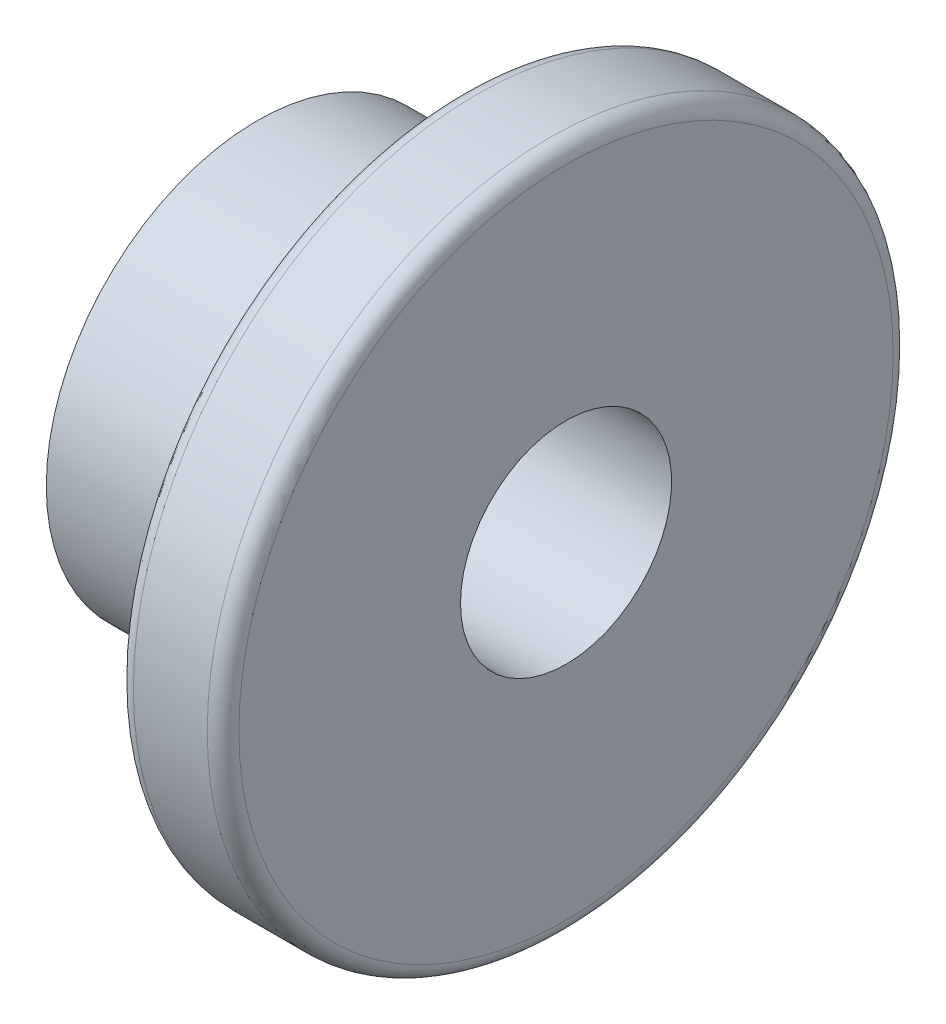
from build123d import *

# Parameters (mm, degrees)
CONG_1_R = 0.6


with BuildPart() as part:
    # Esquisse1 → Révolution1 (revolve)
    with BuildSketch(Plane.XY, mode=Mode.PRIVATE) as r_volution1_sk:
        Polygon((0, 4), (11.7, 4), (11.7, 13), (7.7, 13), (7.7, 8), (0, 8), align=None)
    revolve(r_volution1_sk.sketch.rotate(Axis((0, 0, 0), (1, 0, 0)), 90), axis=Axis((0, 0, 0), (1, 0, 0)))

    # Congé1
    cong_1_edges = [part.edges().sort_by_distance(p)[0] for p in [
        (7.7, 0, -13),
        (11.7, 0, -13),
    ]]
    fillet(cong_1_edges, radius=CONG_1_R)


solid = part.part
